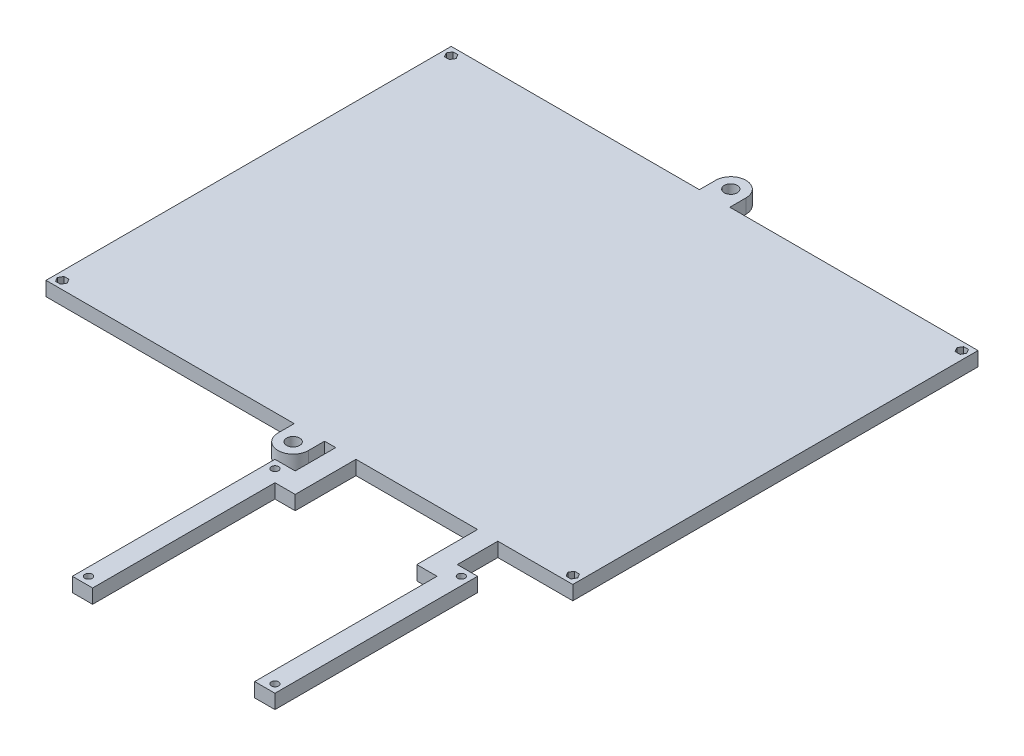
from build123d import *

# Parameters (mm, degrees)
SKETCH1_R           = 1.6
SKETCH1_R_2         = 0.9
BOSS_EXTRUDE1_DEPTH = 3.5
CUT_EXTRUDE1_DEPTH  = 2.3


with BuildPart() as part:
    # Sketch1 → Boss-Extrude1 (new body)
    with BuildSketch(Plane(origin=(0, 0, 0), x_dir=(1, 0, 0), z_dir=(0, 1, 0))):
        with BuildLine():
            Line((0, 0), (61.25, 0))
            Line((61.25, 0), (61.25, 4))
            ThreePointArc((61.25, 4), (65, 7.75), (68.75, 4))
            Line((68.75, 4), (68.75, 0))
            Line((68.75, 0), (130, 0))
            Line((130, 0), (130, -100))
            Line((130, -100), (111.5, -100))
            Line((111.5, -100), (111.5, -110))
            Line((111.5, -110), (116.5, -110))
            Line((116.5, -110), (116.5, -160))
            Line((116.5, -160), (111.5, -160))
            Line((111.5, -160), (111.5, -115))
            Line((111.5, -115), (106.5, -115))
            Line((106.5, -115), (106.5, -110))
            Line((106.5, -110), (106.5, -100))
            Line((106.5, -100), (76.5, -100))
            Line((76.5, -100), (76.5, -110))
            Line((76.5, -110), (76.5, -115))
            Line((76.5, -115), (71.5, -115))
            Line((71.5, -115), (71.5, -160))
            Line((71.5, -160), (66.5, -160))
            Line((66.5, -160), (66.5, -110))
            Line((66.5, -110), (71.5, -110))
            Line((71.5, -110), (71.5, -100))
            Line((71.5, -100), (68.75, -100))
            Line((68.75, -100), (68.75, -104))
            ThreePointArc((68.75, -104), (65, -107.75), (61.25, -104))
            Line((61.25, -104), (61.25, -100))
            Line((61.25, -100), (0, -100))
            Line((0, -100), (0, 0))
        make_face()
        with Locations(Location((65, 4, 0), (0, 0, 270))):
            Circle(SKETCH1_R, mode=Mode.SUBTRACT)
        with Locations(Location((65, -104, 0), (0, 0, 270))):
            Circle(SKETCH1_R, mode=Mode.SUBTRACT)
        with Locations(Location((114.5, -112, 0), (0, 0, 270))):
            Circle(SKETCH1_R_2, mode=Mode.SUBTRACT)
        with Locations(Location((114.5, -158, 0), (0, 0, 270))):
            Circle(SKETCH1_R_2, mode=Mode.SUBTRACT)
        with Locations(Location((68.5, -158, 0), (0, 0, 270))):
            Circle(SKETCH1_R_2, mode=Mode.SUBTRACT)
        with Locations(Location((68.5, -112, 0), (0, 0, 270))):
            Circle(SKETCH1_R_2, mode=Mode.SUBTRACT)
    extrude(amount=BOSS_EXTRUDE1_DEPTH)

    # Sketch2 → Cut-Extrude1 (cut)
    with BuildSketch(Plane(origin=(0, 3.5, 0), x_dir=(1, 0, 0), z_dir=(0, 1, 0))):
        Polygon((3.212435565, -2), (2.606217783, -0.95), (1.393782217, -0.95), (0.787564435, -2), (1.393782217, -3.05), (2.606217783, -3.05), align=None)
        Polygon((126.787564435, -2), (127.393782217, -3.05), (128.606217783, -3.05), (129.212435565, -2), (128.606217783, -0.95), (127.393782217, -0.95), align=None)
        Polygon((126.787564435, -98), (127.393782217, -99.05), (128.606217783, -99.05), (129.212435565, -98), (128.606217783, -96.95), (127.393782217, -96.95), align=None)
        Polygon((3.212435565, -98), (2.606217783, -96.95), (1.393782217, -96.95), (0.787564435, -98), (1.393782217, -99.05), (2.606217783, -99.05), align=None)
    extrude(amount=-CUT_EXTRUDE1_DEPTH, mode=Mode.SUBTRACT)


solid = part.part
